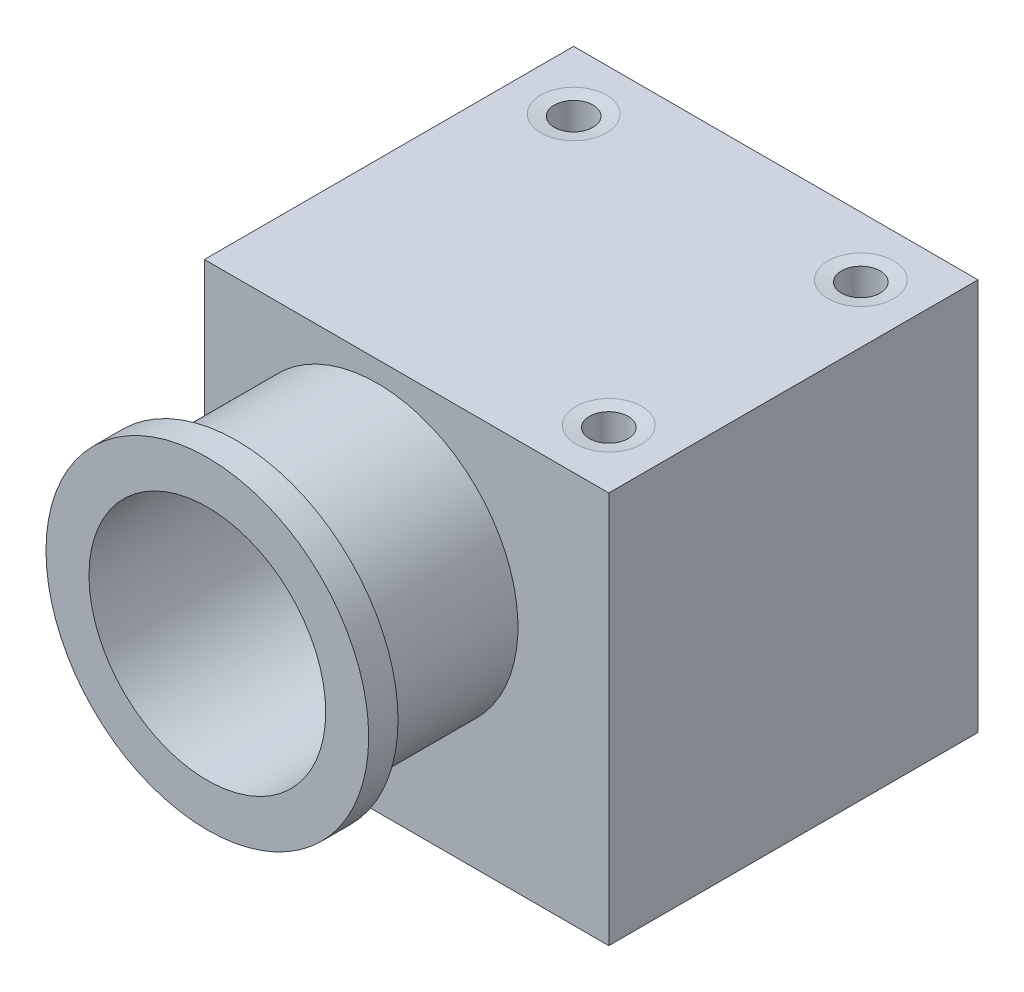
from build123d import *

# Parameters (mm, degrees)
SKETCH1_W           = 14.986
SKETCH1_H           = 16.9926
BOSS_EXTRUDE4_DEPTH = 24.1554
SKETCH10_R          = 1.4224
CUT_EXTRUDE6_DEPTH  = 24.1554
SKETCH11_R          = 3.2639
CUT_EXTRUDE7_DEPTH  = 19.558
SKETCH12_R          = 5.1308
CUT_EXTRUDE8_DEPTH  = 18.288
SKETCH13_W          = 14.986
SKETCH13_H          = 16.9926
SKETCH13_R          = 5.1308
CUT_EXTRUDE9_DEPTH  = 7.366
BOSS_EXTRUDE5_START = 6.096
SKETCH14_R          = 6.096
SKETCH14_R_2        = 5.1308
BOSS_EXTRUDE5_DEPTH = 6.096
BOSS_EXTRUDE6_START = 1.27
SKETCH15_R          = 6.9926
SKETCH15_R_2        = 5.1308
BOSS_EXTRUDE6_DEPTH = 1.27
SKETCH16_W          = 14.986
SKETCH16_H          = 16.9926
CUT_EXTRUDE10_DEPTH = 0.7874
SKETCH18_W          = 16.002
SKETCH18_H          = 16.9926
BOSS_EXTRUDE7_DEPTH = 2.54
SKETCH19_R          = 0.8382
CUT_EXTRUDE11_DEPTH = 20.32
SKETCH24_W          = 13.1826
SKETCH24_H          = 0.7874
CUT_EXTRUDE14_DEPTH = 16.256


with BuildPart() as part:
    # Sketch1 → Boss-Extrude4 (new body)
    with BuildSketch(Plane.XY):
        Rectangle(SKETCH1_W, SKETCH1_H)
    extrude(amount=-BOSS_EXTRUDE4_DEPTH)

    # Sketch10 → Cut-Extrude6 (cut)
    with BuildSketch(Plane.XY):
        with Locations((0, 1.5037)):
            Circle(SKETCH10_R)
    extrude(amount=-CUT_EXTRUDE6_DEPTH, mode=Mode.SUBTRACT)

    # Sketch11 → Cut-Extrude7 (cut)
    with BuildSketch(Plane.XY):
        with Locations((0, 1.5037)):
            Circle(SKETCH11_R)
    extrude(amount=-CUT_EXTRUDE7_DEPTH, mode=Mode.SUBTRACT)

    # Sketch12 → Cut-Extrude8 (cut)
    with BuildSketch(Plane.XY):
        with Locations((0, 1.5037)):
            Circle(SKETCH12_R)
    extrude(amount=-CUT_EXTRUDE8_DEPTH, mode=Mode.SUBTRACT)

    # Sketch13 → Cut-Extrude9 (cut)
    with BuildSketch(Plane.XY):
        Rectangle(SKETCH13_W, SKETCH13_H)
        with Locations((0, 1.5037)):
            Circle(SKETCH13_R, mode=Mode.SUBTRACT)
    extrude(amount=-CUT_EXTRUDE9_DEPTH, mode=Mode.SUBTRACT)

    # Sketch14 → Boss-Extrude5 (add)
    with BuildSketch(Plane.XY.offset(-7.366).offset(BOSS_EXTRUDE5_START)):
        with Locations(Location((0, 1.5037, 0), (0, 0, 180))):
            Circle(SKETCH14_R)
        with Locations((0, 1.5037)):
            Circle(SKETCH14_R_2, mode=Mode.SUBTRACT)
    extrude(amount=-BOSS_EXTRUDE5_DEPTH)

    # Sketch15 → Boss-Extrude6 (add)
    with BuildSketch(Plane.XY.offset(-1.27).offset(BOSS_EXTRUDE6_START)):
        with Locations((0, 1.5037)):
            Circle(SKETCH15_R)
        with Locations((0, 1.5037)):
            Circle(SKETCH15_R_2, mode=Mode.SUBTRACT)
    extrude(amount=-BOSS_EXTRUDE6_DEPTH)

    # Sketch16 → Cut-Extrude10 (cut)
    with BuildSketch(Plane(origin=(0, 0, -24.1554), x_dir=(-1, 0, 0), z_dir=(0, 0, -1))):
        Rectangle(SKETCH16_W, SKETCH16_H)
    extrude(amount=-CUT_EXTRUDE10_DEPTH, mode=Mode.SUBTRACT)

    # Sketch18 → Boss-Extrude7 (add)
    with BuildSketch(Plane(origin=(7.493, 0, 0), x_dir=(0, 0, -1), z_dir=(1, 0, 0))):
        with Locations((15.367, 0)):
            Rectangle(SKETCH18_W, SKETCH18_H)
    extrude(amount=BOSS_EXTRUDE7_DEPTH)

    # Sketch19 → Cut-Extrude11 (cut)
    with BuildSketch(Plane(origin=(0, 8.4963, 0), x_dir=(1, 0, 0), z_dir=(0, 1, 0))):
        with Locations(Location((-4.953, 20.828, 0), (0, 0, 270))):
            Circle(SKETCH19_R)
        with Locations(Location((7.493, 20.828, 0), (0, 0, 270))):
            Circle(SKETCH19_R)
        with Locations(Location((7.493, 9.906, 0), (0, 0, 270))):
            Circle(SKETCH19_R)
    extrude(amount=-CUT_EXTRUDE11_DEPTH, mode=Mode.SUBTRACT)

    # Cut-Extrude13 cone 1 section (through the dimple's axis) → Cut-Extrude13 (revolve, cut)
    with BuildSketch(Plane(origin=(-4.953, 8.4963, -20.828), x_dir=(0, 0, 1), z_dir=(1, 0, 0))):
        Polygon((0, 0), (1.4224, 0), (0, 0.199905283), align=None)
    revolve(axis=Axis((-4.953, 8.4963, -20.828), (0, -1, 0)), mode=Mode.SUBTRACT)

    # Cut-Extrude13 cone 2 section (through the dimple's axis) → Cut-Extrude13 cone 2 (revolve, cut)
    with BuildSketch(Plane(origin=(7.493, 8.4963, -20.828), x_dir=(0, 0, 1), z_dir=(1, 0, 0))):
        Polygon((0, 0), (1.4224, 0), (0, 0.199905283), align=None)
    revolve(axis=Axis((7.493, 8.4963, -20.828), (0, -1, 0)), mode=Mode.SUBTRACT)

    # Cut-Extrude13 cone 3 section (through the dimple's axis) → Cut-Extrude13 cone 3 (revolve, cut)
    with BuildSketch(Plane(origin=(7.493, 8.4963, -9.906), x_dir=(0, 0, 1), z_dir=(1, 0, 0))):
        Polygon((0, 0), (1.4224, 0), (0, 0.199905283), align=None)
    revolve(axis=Axis((7.493, 8.4963, -9.906), (0, -1, 0)), mode=Mode.SUBTRACT)

    # Sketch24 → Cut-Extrude14 (cut)
    with BuildSketch(Plane.XZ.offset(8.4963)):
        with Locations((0, -17.8689)):
            Rectangle(SKETCH24_W, SKETCH24_H)
    extrude(amount=-CUT_EXTRUDE14_DEPTH, mode=Mode.SUBTRACT)


solid = part.part
